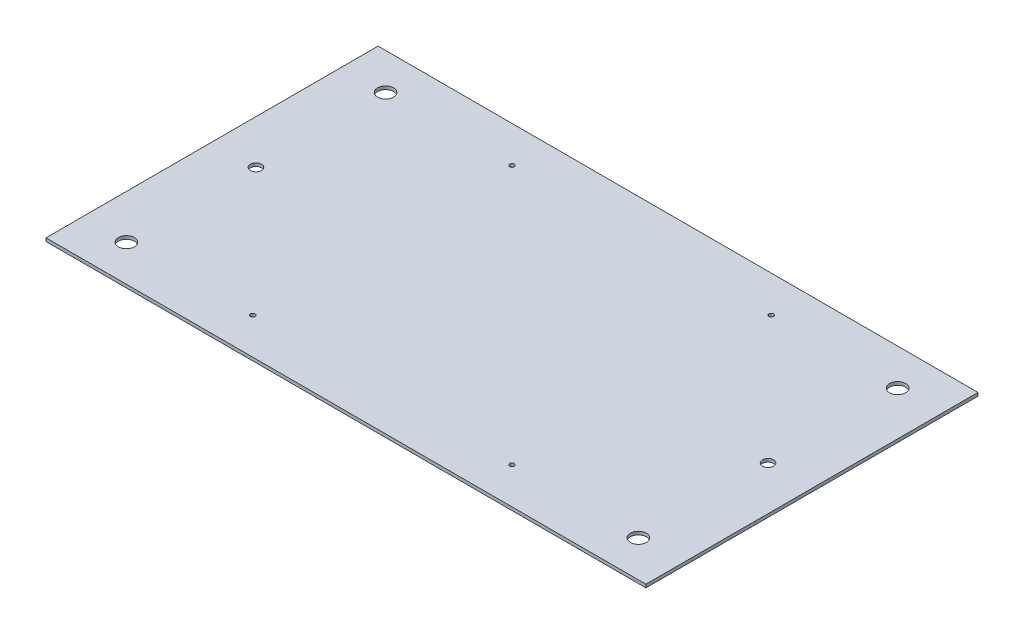
from build123d import *

# Parameters (mm, degrees)
SKETCH2_W           = 560
SKETCH2_H           = 310
BOSS_EXTRUDE1_DEPTH = 3
SKETCH3_R           = 2.15
CUT_EXTRUDE1_DEPTH  = 641.085150585
SKETCH4_R           = 5.15
CUT_EXTRUDE2_DEPTH  = 641.085150585
SKETCH5_R           = 7.5
CUT_EXTRUDE3_DEPTH  = 641.085150585


with BuildPart() as part:
    # Sketch2 → Boss-Extrude1 (new body)
    with BuildSketch(Plane(origin=(0, 0, 0), x_dir=(1, 0, 0), z_dir=(0, 1, 0))):
        with Locations((280, 155)):
            Rectangle(SKETCH2_W, SKETCH2_H)
    extrude(amount=BOSS_EXTRUDE1_DEPTH)

    # Sketch3 → Cut-Extrude1 (cut, through all)
    with BuildSketch(Plane(origin=(0, 3, 0), x_dir=(1, 0, 0), z_dir=(0, 1, 0))):
        with Locations(Location((159, 276, 0), (0, 0, 270))):
            Circle(SKETCH3_R)
        with Locations(Location((401, 276, 0), (0, 0, 270))):
            Circle(SKETCH3_R)
        with Locations(Location((401, 34, 0), (0, 0, 270))):
            Circle(SKETCH3_R)
        with Locations(Location((159, 34, 0), (0, 0, 270))):
            Circle(SKETCH3_R)
    extrude(amount=-CUT_EXTRUDE1_DEPTH, mode=Mode.SUBTRACT)

    # Sketch4 → Cut-Extrude2 (cut, through all)
    with BuildSketch(Plane(origin=(0, 3, 0), x_dir=(1, 0, 0), z_dir=(0, 1, 0))):
        with Locations(Location((41, 155, 0), (0, 0, 270))):
            Circle(SKETCH4_R)
        with Locations(Location((519, 155, 0), (0, 0, 270))):
            Circle(SKETCH4_R)
    extrude(amount=-CUT_EXTRUDE2_DEPTH, mode=Mode.SUBTRACT)

    # Sketch5 → Cut-Extrude3 (cut, through all)
    with BuildSketch(Plane(origin=(0, 3, 0), x_dir=(1, 0, 0), z_dir=(0, 1, 0))):
        with Locations(Location((41, 34, 0), (0, 0, 270))):
            Circle(SKETCH5_R)
        with Locations(Location((41, 276, 0), (0, 0, 270))):
            Circle(SKETCH5_R)
        with Locations(Location((519, 276, 0), (0, 0, 270))):
            Circle(SKETCH5_R)
        with Locations(Location((519, 34, 0), (0, 0, 270))):
            Circle(SKETCH5_R)
    extrude(amount=-CUT_EXTRUDE3_DEPTH, mode=Mode.SUBTRACT)


solid = part.part
